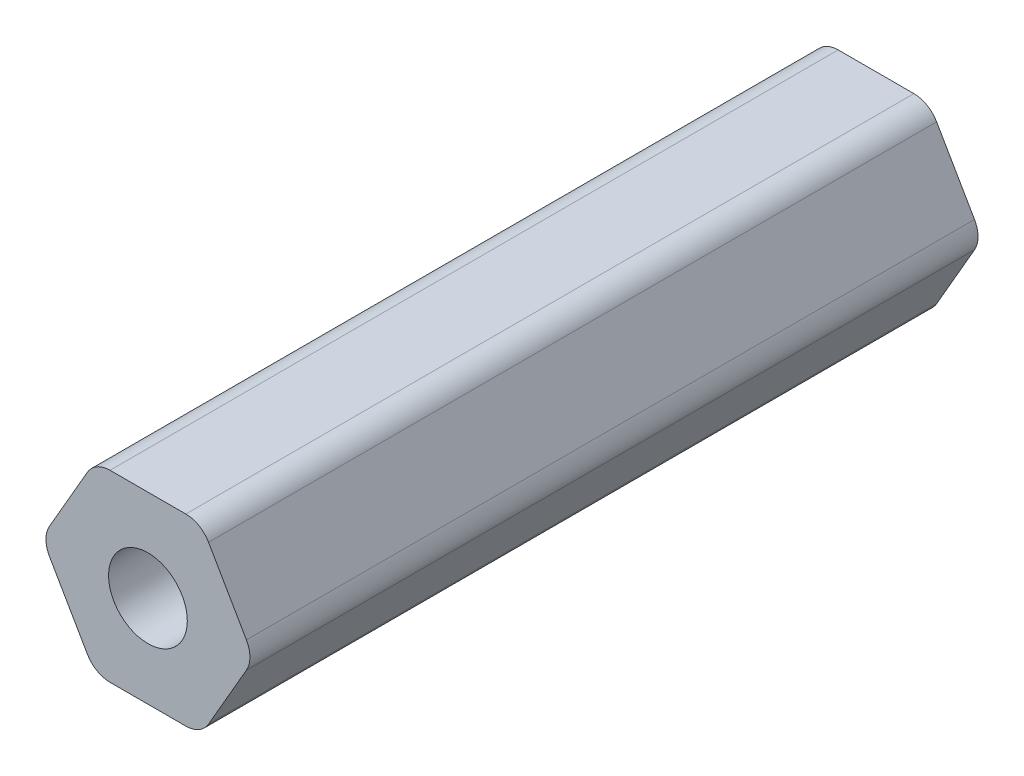
from build123d import *

# Parameters (mm, degrees)
SKETCH_1_R      = 1.5
EXTRUDE_1_DEPTH = 27.75


with BuildPart() as part:
    # Эскиз1 → Бобышка-Вытянуть1 (new body)
    with BuildSketch(Plane.XY):
        with BuildLine():
            Line((3.75277675, 0.5), (2.309401077, 3))
            ThreePointArc((2.309401077, 3), (1.943375673, 3.366025404), (1.443375673, 3.5))
            Line((1.443375673, 3.5), (-1.443375673, 3.5))
            ThreePointArc((-1.443375673, 3.5), (-1.943375673, 3.366025404), (-2.309401077, 3))
            Line((-2.309401077, 3), (-3.75277675, 0.5))
            ThreePointArc((-3.75277675, 0.5), (-3.886751346, 0), (-3.75277675, -0.5))
            Line((-3.75277675, -0.5), (-2.309401077, -3))
            ThreePointArc((-2.309401077, -3), (-1.943375673, -3.366025404), (-1.443375673, -3.5))
            Line((-1.443375673, -3.5), (1.443375673, -3.5))
            ThreePointArc((1.443375673, -3.5), (1.943375673, -3.366025404), (2.309401077, -3))
            Line((2.309401077, -3), (3.75277675, -0.5))
            ThreePointArc((3.75277675, -0.5), (3.886751346, 0), (3.75277675, 0.5))
        make_face()
        Circle(SKETCH_1_R, mode=Mode.SUBTRACT)
    extrude(amount=EXTRUDE_1_DEPTH)


solid = part.part
